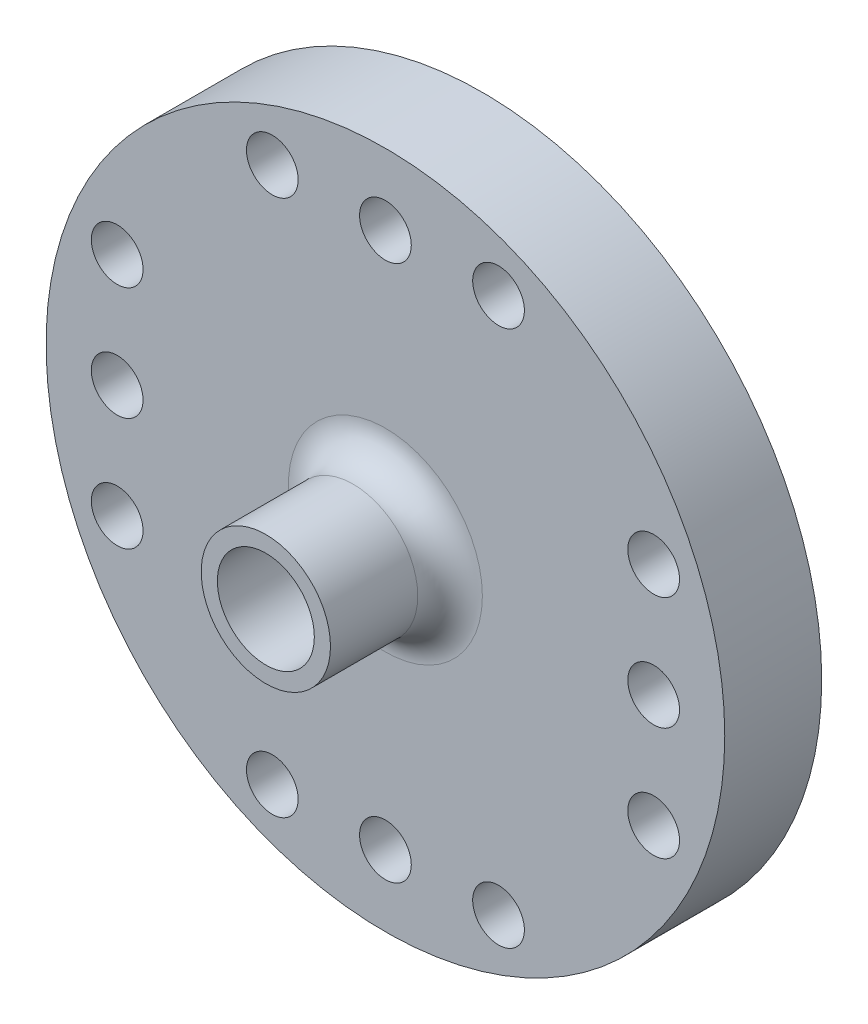
from build123d import *

# Parameters (mm, degrees)
ESQUISSE1_R        = 10.5
ESQUISSE1_R_2      = 0.8
ESQUISSE1_R_3      = 1.5
BOSS_EXTRU_1_DEPTH = 3
ESQUISSE3_R        = 2
ESQUISSE3_R_2      = 1.5
BOSS_EXTRU_2_DEPTH = 3.7
CONG_1_R           = 1


with BuildPart() as part:
    # Esquisse1 → Boss.-Extru.1 (new body)
    with BuildSketch(Plane.XY):
        with Locations((-15.570186162, 4.534749907)):
            Circle(ESQUISSE1_R)
        with Locations((-12.070186162, 12.834749907)):
            Circle(ESQUISSE1_R_2, mode=Mode.SUBTRACT)
        with Locations((-15.570186162, 4.534749907)):
            Circle(ESQUISSE1_R_3, mode=Mode.SUBTRACT)
        with Locations((-7.270186162, 4.534749907)):
            Circle(ESQUISSE1_R_2, mode=Mode.SUBTRACT)
        with Locations((-15.570186162, 12.834749907)):
            Circle(ESQUISSE1_R_2, mode=Mode.SUBTRACT)
        with Locations((-23.870186162, 4.534749907)):
            Circle(ESQUISSE1_R_2, mode=Mode.SUBTRACT)
        with Locations((-15.570186162, -3.765250093)):
            Circle(ESQUISSE1_R_2, mode=Mode.SUBTRACT)
        with Locations((-19.070186162, 12.834749907)):
            Circle(ESQUISSE1_R_2, mode=Mode.SUBTRACT)
        with Locations((-19.070186162, -3.765250093)):
            Circle(ESQUISSE1_R_2, mode=Mode.SUBTRACT)
        with Locations((-12.070186162, -3.765250093)):
            Circle(ESQUISSE1_R_2, mode=Mode.SUBTRACT)
        with Locations((-7.270186162, 8.034749907)):
            Circle(ESQUISSE1_R_2, mode=Mode.SUBTRACT)
        with Locations((-7.270186162, 1.034749907)):
            Circle(ESQUISSE1_R_2, mode=Mode.SUBTRACT)
        with Locations((-23.870186162, 1.034749907)):
            Circle(ESQUISSE1_R_2, mode=Mode.SUBTRACT)
        with Locations((-23.870186162, 8.034749907)):
            Circle(ESQUISSE1_R_2, mode=Mode.SUBTRACT)
    extrude(amount=BOSS_EXTRU_1_DEPTH)

    # Esquisse3 → Boss.-Extru.2 (add)
    with BuildSketch(Plane.XY.offset(3)):
        with Locations((-15.570186162, 4.534749907)):
            Circle(ESQUISSE3_R)
        with Locations((-15.570186162, 4.534749907)):
            Circle(ESQUISSE3_R_2, mode=Mode.SUBTRACT)
    extrude(amount=BOSS_EXTRU_2_DEPTH)

    # Congé1
    cong_1_edges = [part.edges().sort_by_distance(p)[0] for p in [
        (-17.570186162, 4.534749907, 3),
    ]]
    fillet(cong_1_edges, radius=CONG_1_R)


solid = part.part
